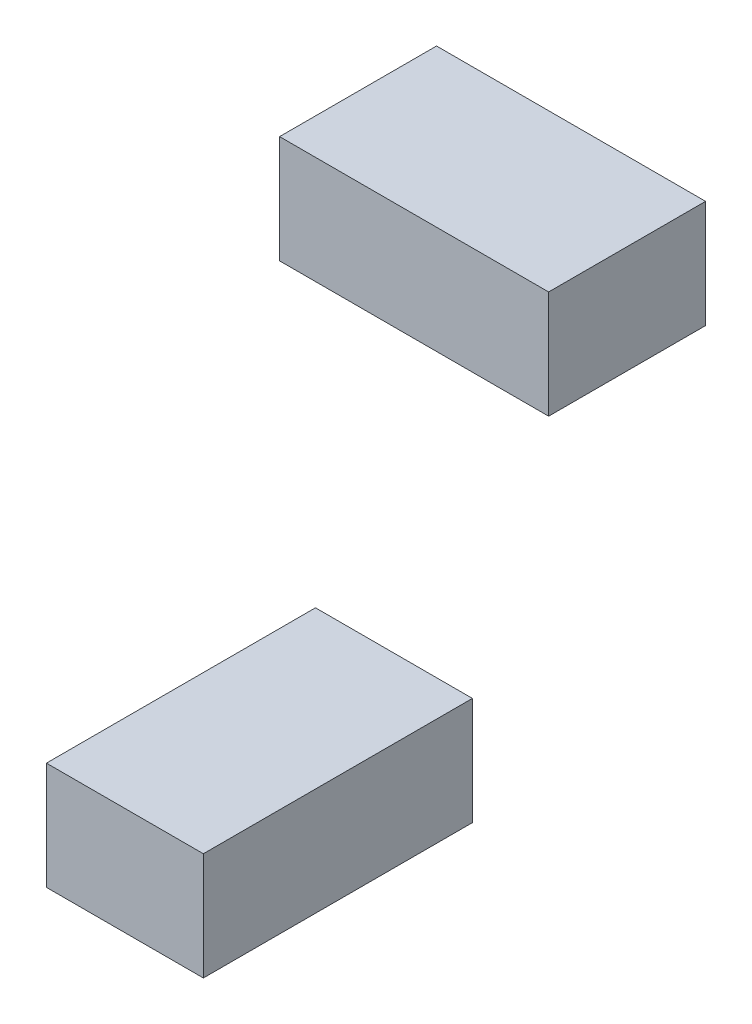
from build123d import *

# Parameters (mm, degrees)
SKETCH1_W             = 0.889
SKETCH1_H             = 1.524
BOSS_EXTRUDE1_DEPTH   = 0.6096
SKETCH1_W_2           = 1.524
SKETCH1_H_2           = 0.889
BOSS_EXTRUDE1_2_DEPTH = 0.6096


with BuildPart() as part:
    # Sketch1 → Boss-Extrude1 (new body)
    with BuildSketch(Plane(origin=(0, 0, 0), x_dir=(1, 0, 0), z_dir=(0, 1, 0))):
        with Locations((-4.3815, 14.7828)):
            Rectangle(SKETCH1_W, SKETCH1_H)
    extrude(amount=BOSS_EXTRUDE1_DEPTH)


with BuildPart() as body_2:
    # Sketch1 → Boss-Extrude1 2 (new body)
    with BuildSketch(Plane(origin=(0, 0, 0), x_dir=(1, 0, 0), z_dir=(0, 1, 0))):
        with Locations((-6.477, 18.1991)):
            Rectangle(SKETCH1_W_2, SKETCH1_H_2)
    extrude(amount=BOSS_EXTRUDE1_2_DEPTH)


solid = Compound([part.part, body_2.part])
